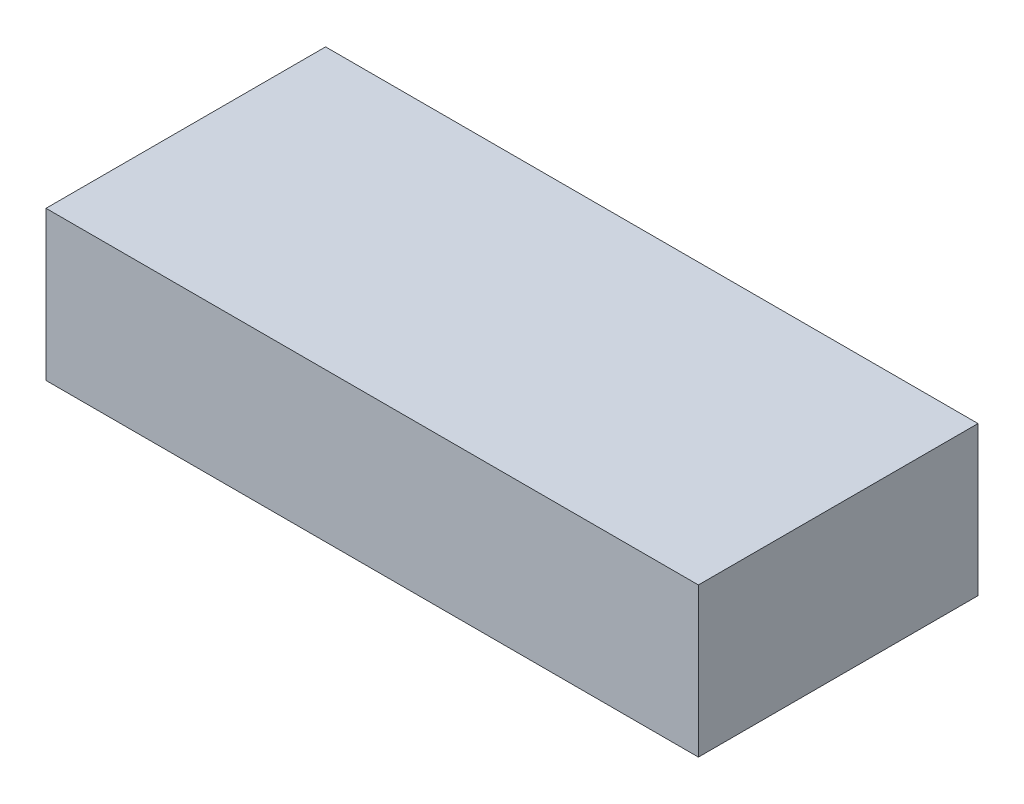
from build123d import *

# Parameters (mm, degrees)
SKETCH1_W           = 7
SKETCH1_H           = 3
BOSS_EXTRUDE1_DEPTH = 1.6


with BuildPart() as part:
    # Sketch1 → Boss-Extrude1 (new body)
    with BuildSketch(Plane(origin=(0, 0, 0), x_dir=(1, 0, 0), z_dir=(0, 1, 0))):
        with Locations((3.5, 1.5)):
            Rectangle(SKETCH1_W, SKETCH1_H)
    extrude(amount=BOSS_EXTRUDE1_DEPTH)


solid = part.part
